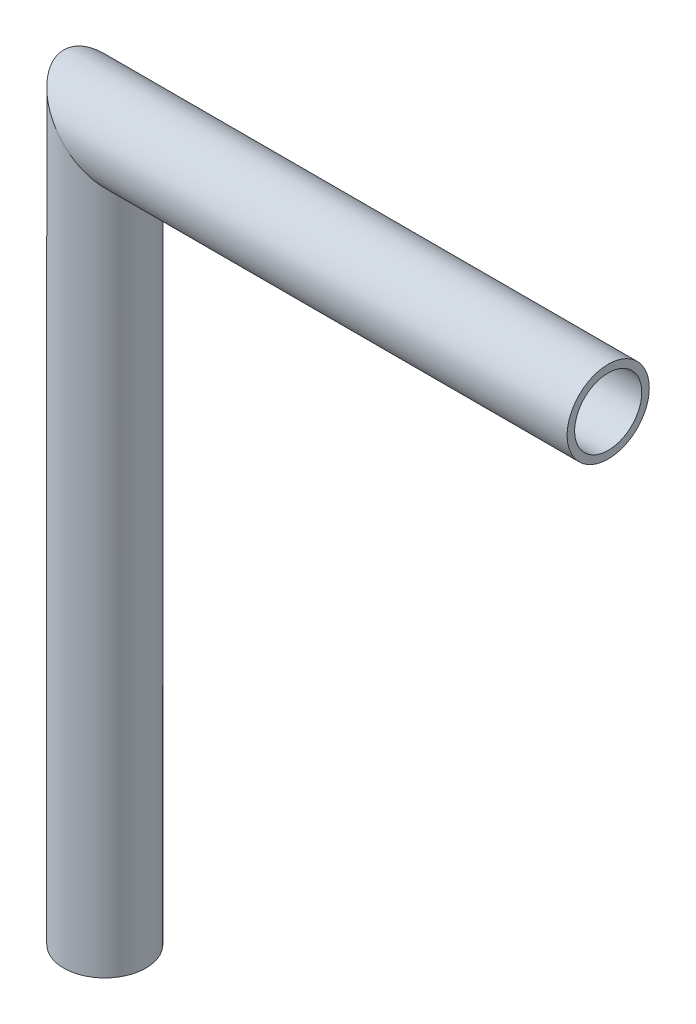
from build123d import *

# Parameters (mm, degrees)
SKETCH2_R   = 9.790319171
SKETCH2_R_2 = 8


with BuildPart() as part:
    # Sweep1: sweep along a path in Sketch1
    with BuildLine(Plane.XY) as sweep1_path:
        Line((0, 0), (0, 170))
        Line((0, 170), (120, 170))
    # Sketch2 → Sweep1 (sweep)
    with BuildSketch(Plane(origin=(120, 170, 0), x_dir=(0, 0, -1), z_dir=(1, 0, 0))):
        Circle(SKETCH2_R)
        Circle(SKETCH2_R_2, mode=Mode.SUBTRACT)
    sweep(path=sweep1_path.line, transition=Transition.RIGHT)


solid = part.part
